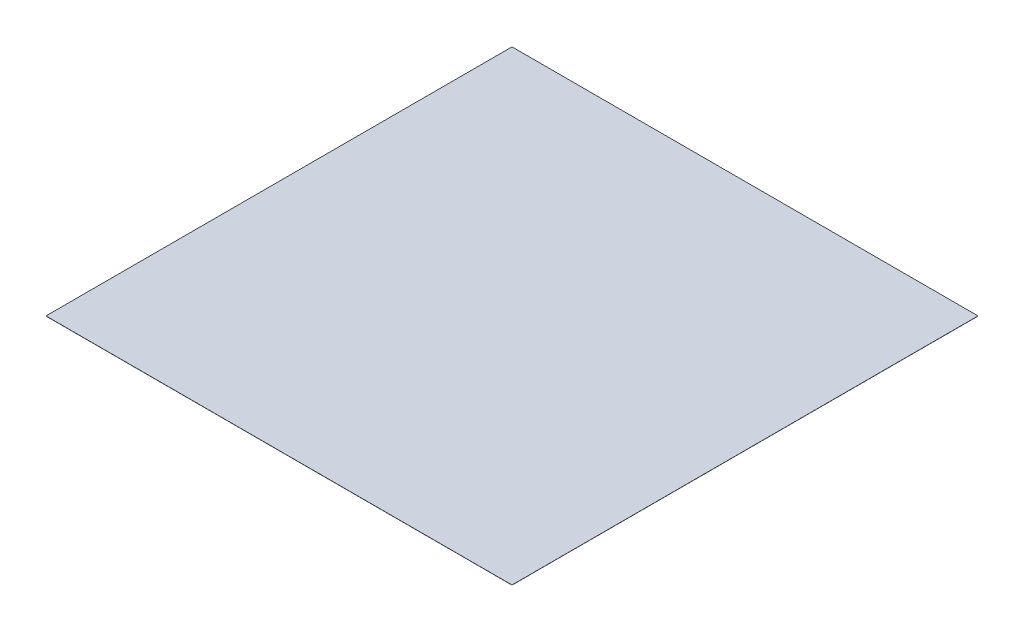
from build123d import *

# Parameters (mm, degrees)
ESBO_O1_W                 = 30
ESBO_O1_H                 = 30
RESSALTO_EXTRUS_O20_DEPTH = 0.01


with BuildPart() as part:
    # Esboço1 → Ressalto-extrusão20 (new body)
    with BuildSketch(Plane(origin=(0, 0, 0), x_dir=(1, 0, 0), z_dir=(0, 1, 0))):
        with Locations((-879.212221257, 384.524350277)):
            Rectangle(ESBO_O1_W, ESBO_O1_H)
    extrude(amount=RESSALTO_EXTRUS_O20_DEPTH)


solid = part.part
